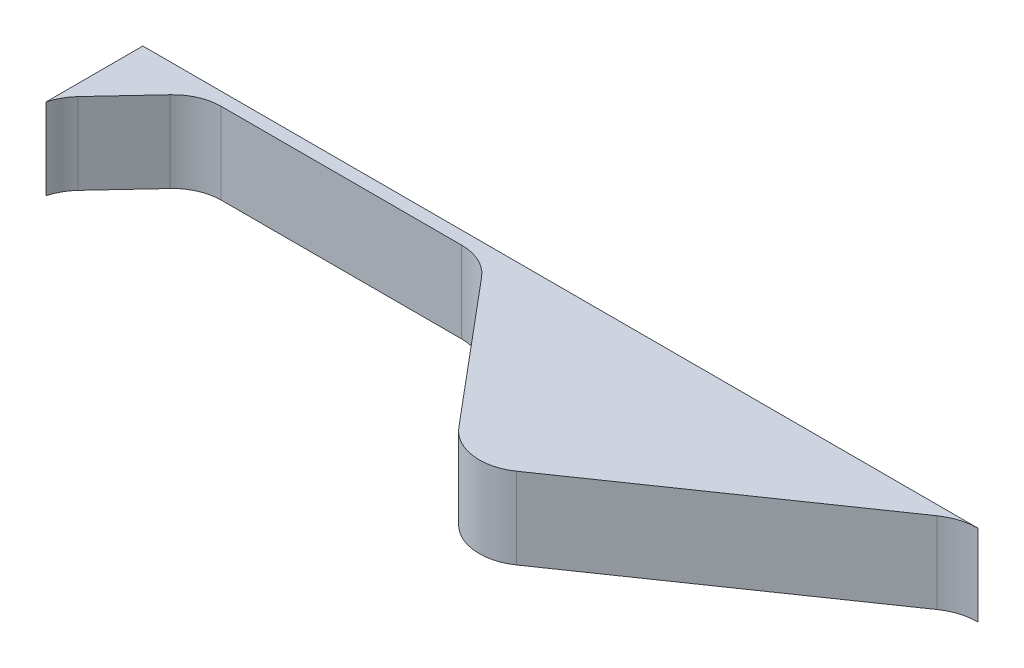
from build123d import *

# Parameters (mm, degrees)
BOSS_EXTRUDE1_DEPTH = 6.35


with BuildPart() as part:
    # Sketch1 → Boss-Extrude1 (new body)
    with BuildSketch(Plane(origin=(0, 0, 0), x_dir=(1, 0, 0), z_dir=(0, 1, 0))):
        with BuildLine():
            Line((0, 0), (0, 7.57119509))
            Line((0, 7.57119509), (65.278, 7.57119509))
            ThreePointArc((65.278, 7.57119509), (63.993935294, 7.375852222), (62.826050709, 6.807497929))
            Line((62.826050709, 6.807497929), (43.381923411, -6.606107017))
            ThreePointArc((43.381923411, -6.606107017), (40.638946364, -7.262106405), (38.168659449, -5.901246074))
            Line((38.168659449, -5.901246074), (28.862380436, 5.189545373))
            ThreePointArc((28.862380436, 5.189545373), (27.553926685, 6.193557249), (25.943751107, 6.55052458))
            Line((25.943751107, 6.55052458), (7.147751107, 6.55052458))
            ThreePointArc((7.147751107, 6.55052458), (5.628517155, 6.234523464), (4.361293504, 5.338938332))
            Line((4.361293504, 5.338938332), (0.896741835, 1.623661528))
            ThreePointArc((0.896741835, 1.623661528), (0.348055551, 0.867234544), (0, 0))
        make_face()
    extrude(amount=BOSS_EXTRUDE1_DEPTH)


solid = part.part
